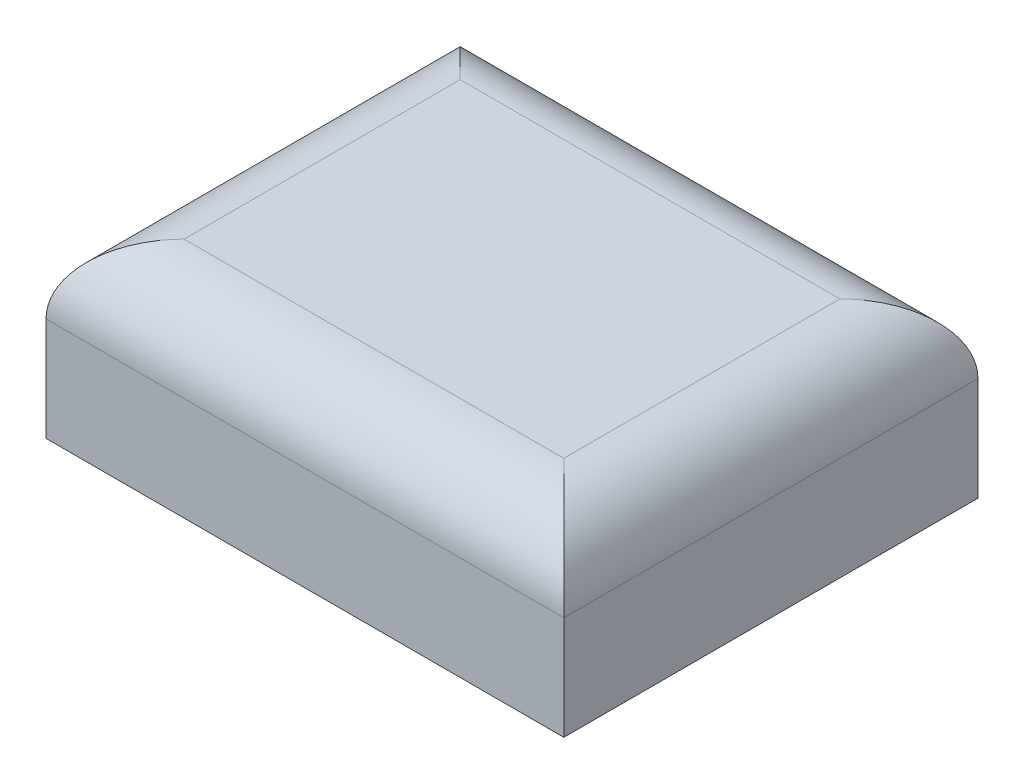
from build123d import *

# Parameters (mm, degrees)
SKETCH1_W           = 150
SKETCH1_H           = 120
BOSS_EXTRUDE1_DEPTH = 50
FILLET1_R           = 20
SHELL1_T            = -5
RIB1_REACH          = 110.282
SKETCH2_WALLS_W     = 358.564078278
SKETCH2_WALLS_H     = 5
SKETCH2_WALLS_W_2   = 360.016478266
SKETCH2_WALLS_W_3   = 5
SKETCH2_WALLS_H_2   = 328.564078278


with BuildPart() as part:
    # Sketch1 → Boss-Extrude1 (new body)
    with BuildSketch(Plane(origin=(0, 0, 0), x_dir=(1, 0, 0), z_dir=(0, 1, 0))):
        Rectangle(SKETCH1_W, SKETCH1_H)
    extrude(amount=BOSS_EXTRUDE1_DEPTH)

    # Fillet1
    fillet1_edges = [part.edges().sort_by_distance(p)[0] for p in [
        (-75, 50, 0),
        (0, 50, 60),
        (75, 50, 0),
        (0, 50, -60),
    ]]
    fillet(fillet1_edges, radius=FILLET1_R)

    # Shell1
    shell1_openings = [part.faces().sort_by_distance(p)[0] for p in [
        (0, 0, 0),
    ]]
    offset(amount=SHELL1_T, openings=shell1_openings)

    # Sketch2 walls → Rib1 (add, up to next)
    with BuildSketch(Plane.XZ, mode=Mode.PRIVATE) as rib1_sk1:
        with Locations((0, -28.619344042)):
            Rectangle(SKETCH2_WALLS_W, SKETCH2_WALLS_H)
    rib1_tool1 = extrude(rib1_sk1.sketch, amount=-RIB1_REACH, mode=Mode.PRIVATE) - part.part
    # Sketch2 walls → Rib1 (add, up to next)
    with BuildSketch(Plane.XZ, mode=Mode.PRIVATE) as rib1_sk2:
        Rectangle(SKETCH2_WALLS_W, SKETCH2_WALLS_H)
    rib1_tool2 = extrude(rib1_sk2.sketch, amount=-RIB1_REACH, mode=Mode.PRIVATE) - part.part
    # Sketch2 walls → Rib1 (add, up to next)
    with BuildSketch(Plane.XZ, mode=Mode.PRIVATE) as rib1_sk3:
        with Locations((0.726199994, 26.711483804)):
            Rectangle(SKETCH2_WALLS_W_2, SKETCH2_WALLS_H)
    rib1_tool3 = extrude(rib1_sk3.sketch, amount=-RIB1_REACH, mode=Mode.PRIVATE) - part.part
    # Sketch2 walls → Rib1 (add, up to next)
    with BuildSketch(Plane.XZ, mode=Mode.PRIVATE) as rib1_sk4:
        Rectangle(SKETCH2_WALLS_W_3, SKETCH2_WALLS_H_2)
    rib1_tool4 = extrude(rib1_sk4.sketch, amount=-RIB1_REACH, mode=Mode.PRIVATE) - part.part
    # Sketch2 walls → Rib1 (add, up to next)
    with BuildSketch(Plane.XZ, mode=Mode.PRIVATE) as rib1_sk5:
        Polygon((-34.534707577, 164.241613139), (-30.373449631, -164.304936346), (-25.37385063, -164.241613139), (-29.535108576, 164.304936346), align=None)
    rib1_tool5 = extrude(rib1_sk5.sketch, amount=-RIB1_REACH, mode=Mode.PRIVATE) - part.part
    # Sketch2 walls → Rib1 (add, up to next)
    with BuildSketch(Plane.XZ, mode=Mode.PRIVATE) as rib1_sk6:
        with Locations((39.408287459, 0)):
            Rectangle(SKETCH2_WALLS_W_3, SKETCH2_WALLS_H_2)
    rib1_tool6 = extrude(rib1_sk6.sketch, amount=-RIB1_REACH, mode=Mode.PRIVATE) - part.part
    add(rib1_tool1.solids().sort_by_distance((0, 0, -28.619344042))[0])
    add(rib1_tool2.solids().sort_by_distance((0, 0, 0))[0])
    add(rib1_tool3.solids().sort_by_distance((0.726199994, 0, 26.711483804))[0])
    add(rib1_tool4.solids().sort_by_distance((0, 0, 0))[0])
    add(rib1_tool5.solids().sort_by_distance((-29.954279104, 0, 0))[0])
    add(rib1_tool6.solids().sort_by_distance((39.408287459, 0, 0))[0])


solid = part.part
